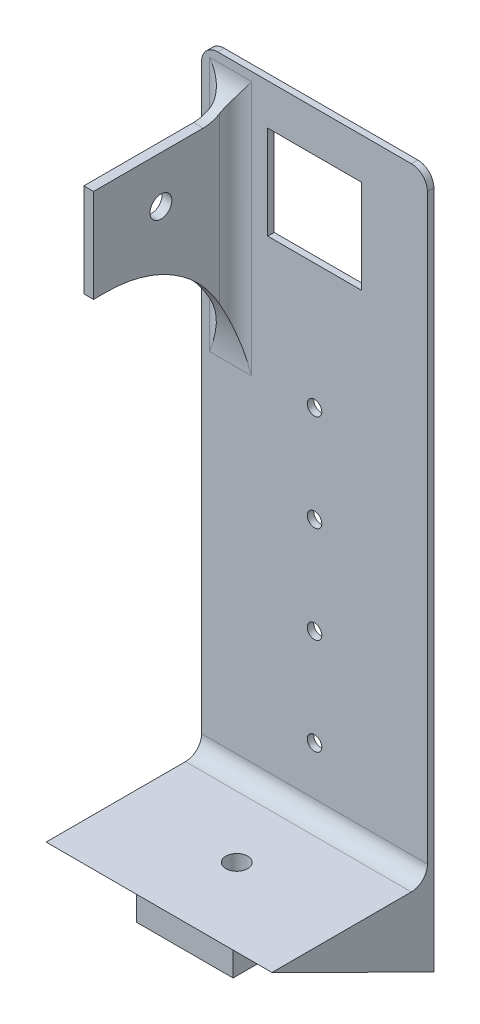
from build123d import *

# Parameters (mm, degrees)
SKETCH1_W                = 70
SKETCH1_H                = 2
BOSS_EXTRUDE1_DEPTH      = 190.5
BOSS_EXTRUDE2_DEPTH      = 70
SKETCH4_W                = 3
SKETCH4_H                = 29
BOSS_EXTRUDE3_DEPTH      = 44
FILLET1_R                = 40
FILLET2_R                = 10
FILLET3_R                = 5
BOSS_EXTRUDE4_DEPTH      = 15
BOSS_EXTRUDE4_DEPTH_BACK = 15
F_1_4_CLEARANCE_HOLE2_D  = 6.7564
F_1_4_CLEARANCE_HOLE3_D  = 6.7564
M4_CLEARANCE_HOLE1_D     = 4.5
FILLET6_R                = 5
SKETCH23_W               = 29
SKETCH23_H               = 29
CUT_EXTRUDE1_DEPTH       = 2
FILLET7_R                = 5
FILLET8_R                = 5
FILLET9_R                = 5


with BuildPart() as part:
    # Sketch1 → Boss-Extrude1 (new body)
    with BuildSketch(Plane(origin=(0, 0, 0), x_dir=(1, 0, 0), z_dir=(0, 1, 0))):
        Rectangle(SKETCH1_W, SKETCH1_H)
    extrude(amount=BOSS_EXTRUDE1_DEPTH)

    # Sketch3 → Boss-Extrude2 (add)
    with BuildSketch(Plane(origin=(35, 0, 0), x_dir=(0, 0, -1), z_dir=(1, 0, 0))):
        Polygon((1, 0), (-49.2, 0), (1, -25), align=None)
    extrude(amount=-BOSS_EXTRUDE2_DEPTH)

    # Sketch4 → Boss-Extrude3 (add)
    with BuildSketch(Plane.XY.offset(1)):
        with Locations((-26, 163.3)):
            Rectangle(SKETCH4_W, SKETCH4_H)
    extrude(amount=BOSS_EXTRUDE3_DEPTH)

    # Fillet1
    fillet1_edges = [part.edges().sort_by_distance(p)[0] for p in [
        (-26, 148.8, 1),
    ]]
    fillet(fillet1_edges, radius=FILLET1_R)

    # Fillet2
    fillet2_edges = [part.edges().sort_by_distance(p)[0] for p in [
        (-26, 177.8, 1),
    ]]
    fillet(fillet2_edges, radius=FILLET2_R)

    # Fillet3
    fillet3_edges = [part.edges().sort_by_distance(p)[0] for p in [
        (-27.5, 148.3, 1),
    ]]
    fillet(fillet3_edges, radius=FILLET3_R)

    # Sketch9 → Boss-Extrude4 (add, two sides: drawn at the far end of the back side and taken through both)
    with BuildSketch(Plane.ZY.offset(-BOSS_EXTRUDE4_DEPTH_BACK)):
        Polygon((41.249412395, -3.959455979), (41.249412395, -15.459455979), (18.157412395, -15.459455979), align=None)
    extrude(amount=BOSS_EXTRUDE4_DEPTH + BOSS_EXTRUDE4_DEPTH_BACK)

    # 1/4 Clearance Hole2 (through all)
    with Locations(Plane(origin=(0, 0, 0), x_dir=(1, 0, 0), z_dir=(0, 1, 0))):
        with Locations((0, -25.1)):
            Hole(F_1_4_CLEARANCE_HOLE2_D / 2)

    # 1/4 Clearance Hole3 (through all)
    with Locations(Plane(origin=(-24.5, 0, 0), x_dir=(0, 0, -1), z_dir=(1, 0, 0))):
        with Locations((-24.1, 163.3)):
            Hole(F_1_4_CLEARANCE_HOLE3_D / 2)

    # M4 Clearance Hole1 (through all)
    with Locations(Plane.XY.offset(1)):
        with Locations((0, 20), (0, 50), (0, 80), (0, 110)):
            Hole(M4_CLEARANCE_HOLE1_D / 2)

    # Fillet6
    fillet6_edges = [part.edges().sort_by_distance(p)[0] for p in [
        (0, 0, 1),
    ]]
    fillet(fillet6_edges, radius=FILLET6_R)

    # Sketch23 → Cut-Extrude1 (cut)
    with BuildSketch(Plane.XY.offset(1)):
        with Locations((0, 163.3)):
            Rectangle(SKETCH23_W, SKETCH23_H)
    extrude(amount=-CUT_EXTRUDE1_DEPTH, mode=Mode.SUBTRACT)

    # Fillet7
    fillet7_edges = [part.edges().sort_by_distance(p)[0] for p in [
        (-24.5, 148.3, 1),
    ]]
    fillet(fillet7_edges, radius=FILLET7_R)

    # Fillet8
    fillet8_edges = [part.edges().sort_by_distance(p)[0] for p in [
        (35, 190.5, 0),
    ]]
    fillet(fillet8_edges, radius=FILLET8_R)

    # Fillet9
    fillet9_edges = [part.edges().sort_by_distance(p)[0] for p in [
        (-35, 190.5, 0),
    ]]
    fillet(fillet9_edges, radius=FILLET9_R)


solid = part.part
